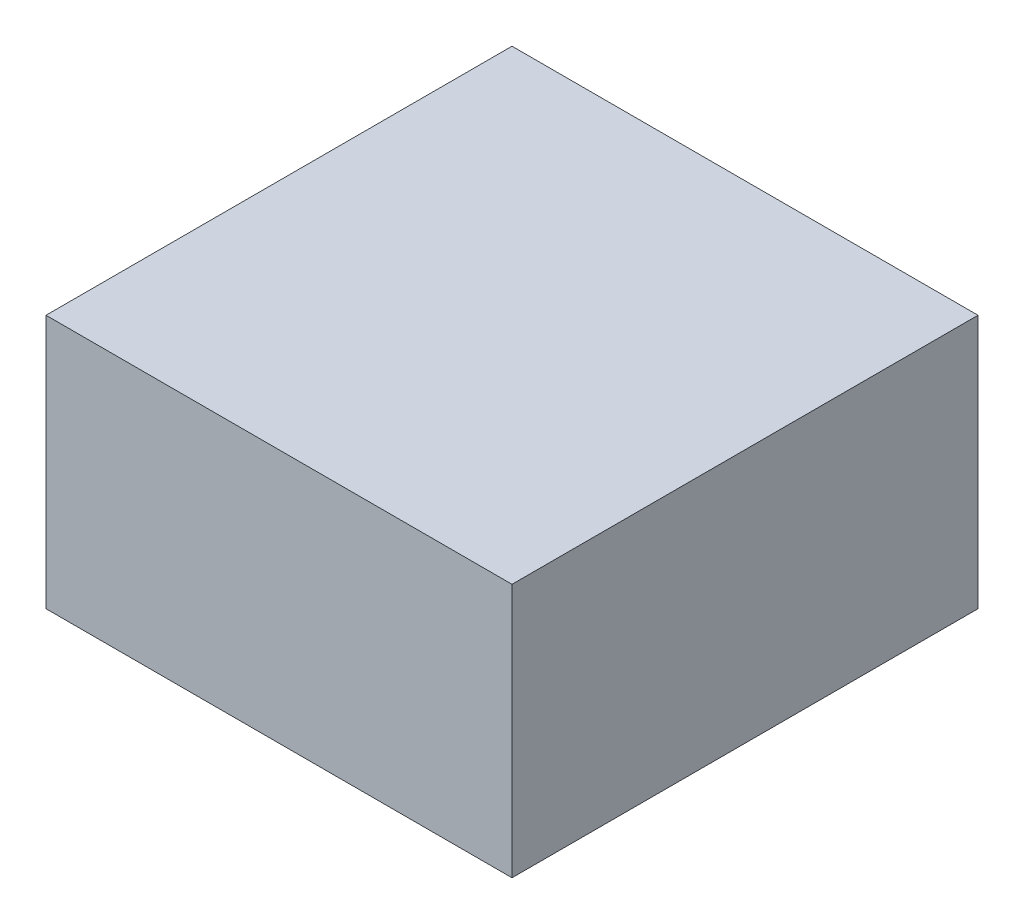
from build123d import *

# Parameters (mm, degrees)
SKETCH1_W           = 220
SKETCH1_H           = 220
BOSS_EXTRUDE1_DEPTH = 120


with BuildPart() as part:
    # Sketch1 → Boss-Extrude1 (new body)
    with BuildSketch(Plane(origin=(0, 0, 0), x_dir=(1, 0, 0), z_dir=(0, 1, 0))):
        with Locations((110, 110)):
            Rectangle(SKETCH1_W, SKETCH1_H)
    extrude(amount=-BOSS_EXTRUDE1_DEPTH)


solid = part.part
